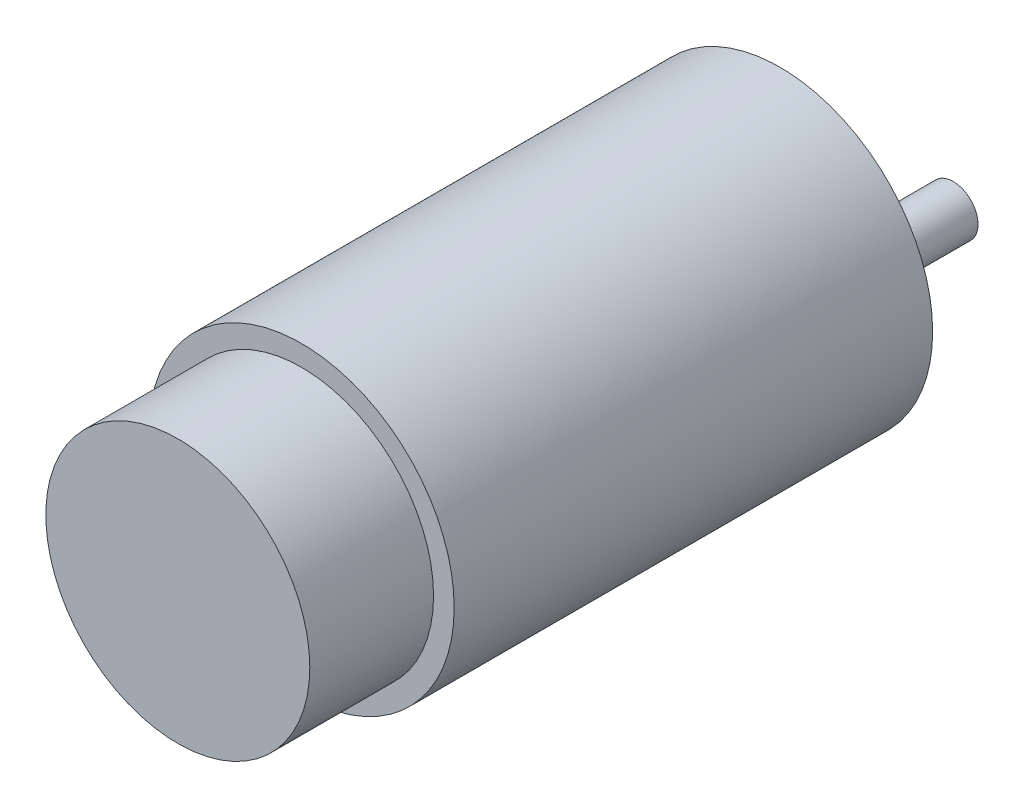
from build123d import *

# Parameters (mm, degrees)
SKETCH_1_R          = 18.5
EXTRUDE_1_DEPTH     = 58
SKETCH_2_R          = 6
EXTRUDE_2_DEPTH     = 6
EXTRUDE_3_DEPTH     = 15
SKETCH_4_R          = 16
EXTRUDE_4_DEPTH     = 15
SKETCH_5_R          = 3
EXTRUDE_5_DEPTH     = 3
SKETCH_6_R          = 1.6
CUT_EXTRUDE_1_DEPTH = 5


with BuildPart() as part:
    # 草图1 → 凸台-拉伸1 (new body)
    with BuildSketch(Plane.XY):
        with Locations(Location((0, 0, 0), (0, 0, 180))):
            Circle(SKETCH_1_R)
    extrude(amount=EXTRUDE_1_DEPTH)

    # 草图2 → 凸台-拉伸2 (add)
    with BuildSketch(Plane(origin=(0, 0, 0), x_dir=(-1, 0, 0), z_dir=(0, 0, -1))):
        with Locations(Location((0, -7, 0), (0, 0, 180))):
            Circle(SKETCH_2_R)
    extrude(amount=EXTRUDE_2_DEPTH)

    # 草图3 → 凸台-拉伸3 (add)
    with BuildSketch(Plane(origin=(0, 0, -6), x_dir=(-1, 0, 0), z_dir=(0, 0, -1))):
        with BuildLine():
            Line((-1.8, -9.4), (1.8, -9.4))
            ThreePointArc((1.8, -9.4), (2.683281573, -8.341640786), (3, -7))
            ThreePointArc((3, -7), (-1.341640786, -4.316718427), (-1.8, -9.4))
        make_face()
    extrude(amount=EXTRUDE_3_DEPTH)

    # 草图5 → 凸台-拉伸5 (add)
    with BuildSketch(Plane(origin=(0, 0, -6), x_dir=(-1, 0, 0), z_dir=(0, 0, -1))):
        with Locations(Location((0, -7, 0), (0, 0, 233.130102354))):
            Circle(SKETCH_5_R)
    extrude(amount=EXTRUDE_5_DEPTH)

    # 草图6 → 切除-拉伸1 (cut)
    with BuildSketch(Plane(origin=(0, 0, 0), x_dir=(-1, 0, 0), z_dir=(0, 0, -1))):
        with Locations((-7.75, -13.423393759)):
            Circle(SKETCH_6_R)
        with Locations((-15.5, 0)):
            Circle(SKETCH_6_R)
        with Locations((-7.75, 13.423393759)):
            Circle(SKETCH_6_R)
        with Locations((7.75, 13.423393759)):
            Circle(SKETCH_6_R)
        with Locations((15.5, 0)):
            Circle(SKETCH_6_R)
        with Locations((7.75, -13.423393759)):
            Circle(SKETCH_6_R)
    extrude(amount=-CUT_EXTRUDE_1_DEPTH, mode=Mode.SUBTRACT)


with BuildPart() as body_2:
    # 草图4 → 凸台-拉伸4 (new body)
    with BuildSketch(Plane.XY.offset(58)):
        Circle(SKETCH_4_R)
    extrude(amount=EXTRUDE_4_DEPTH)


solid = Compound([part.part, body_2.part])
